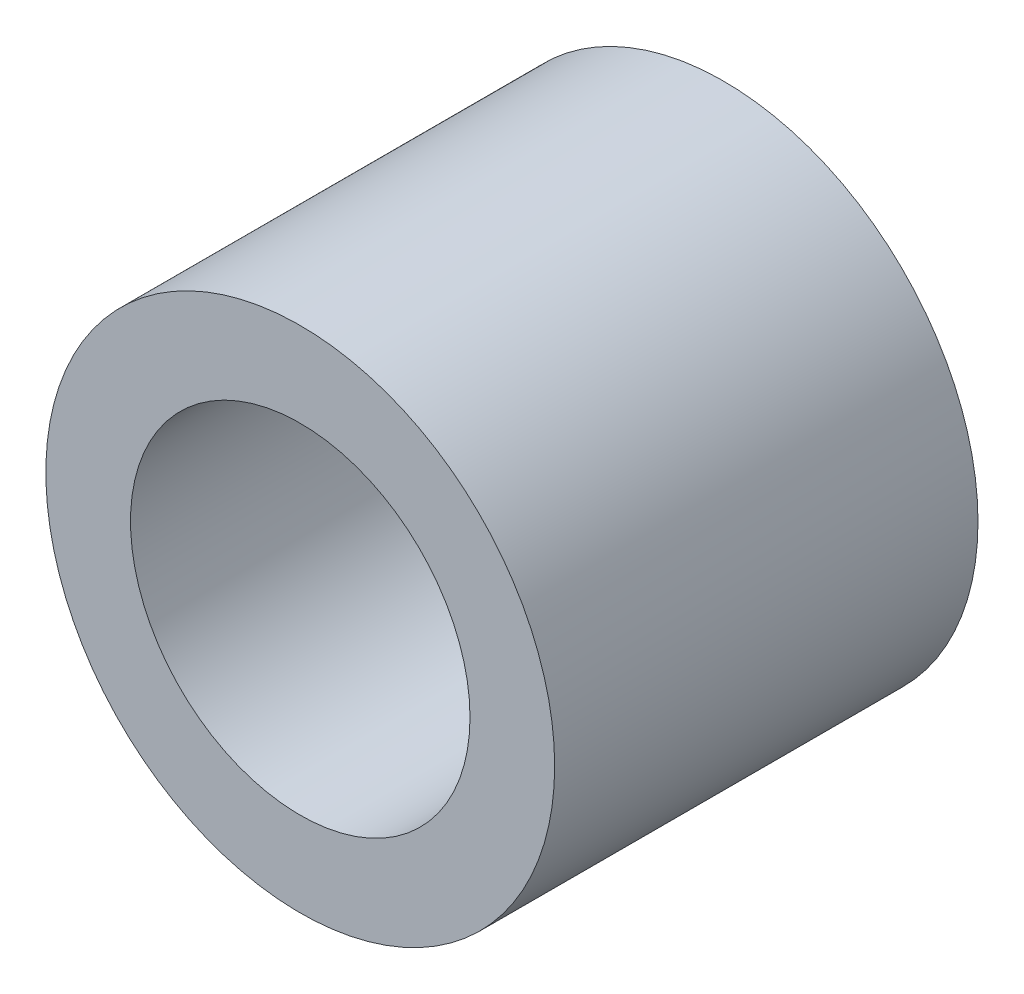
from build123d import *

# Parameters (mm, degrees)
SKETCH_1_R      = 30.05
SKETCH_1_R_2    = 20.05
EXTRUDE_1_DEPTH = 50


with BuildPart() as part:
    # 스케치1 → 보스-돌출1 (new body)
    with BuildSketch(Plane.XY):
        Circle(SKETCH_1_R)
        Circle(SKETCH_1_R_2, mode=Mode.SUBTRACT)
    extrude(amount=EXTRUDE_1_DEPTH)


solid = part.part
